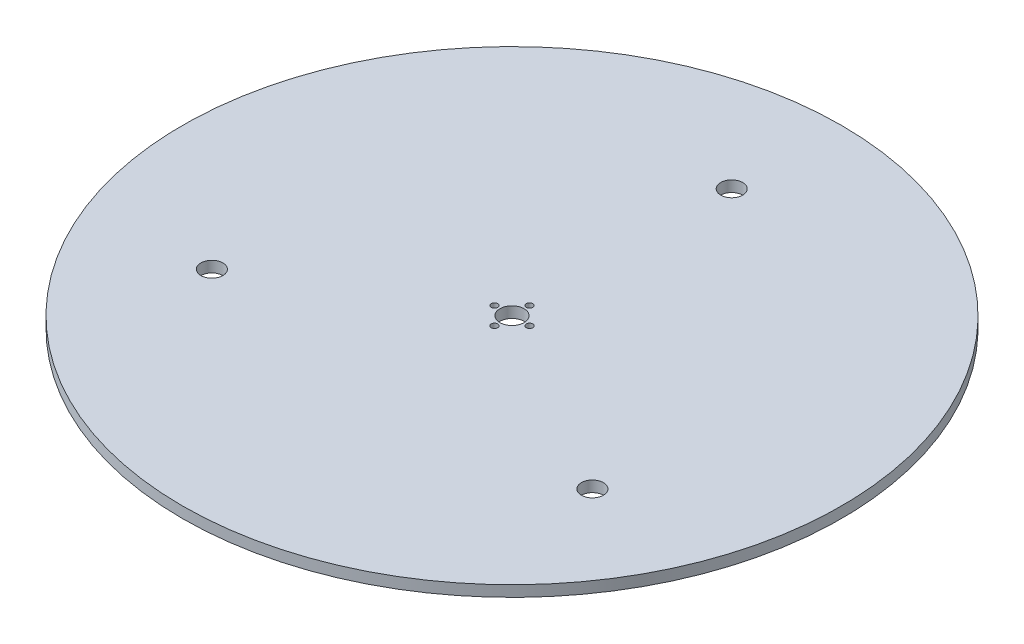
from build123d import *

# Parameters (mm, degrees)
SKETCH_1_R      = 150
SKETCH_1_R_2    = 5
SKETCH_1_R_3    = 5.5
SKETCH_1_R_4    = 1.5
EXTRUDE_1_DEPTH = 5


with BuildPart() as part:
    # 草图1 → 凸台-拉伸1 (new body)
    with BuildSketch(Plane(origin=(0, 0, 0), x_dir=(1, 0, 0), z_dir=(0, 1, 0))):
        with Locations(Location((0, 0, 0), (0, 0, 270))):
            Circle(SKETCH_1_R)
        with Locations(Location((0, 100, 0), (0, 0, 270))):
            Circle(SKETCH_1_R_2, mode=Mode.SUBTRACT)
        with Locations(Location((-86.602540378, -50, 0), (0, 0, 270))):
            Circle(SKETCH_1_R_2, mode=Mode.SUBTRACT)
        with Locations(Location((86.602540378, -50, 0), (0, 0, 270))):
            Circle(SKETCH_1_R_2, mode=Mode.SUBTRACT)
        with Locations(Location((0, 0, 0), (0, 0, 270))):
            Circle(SKETCH_1_R_3, mode=Mode.SUBTRACT)
        with Locations(Location((0, 8, 0), (0, 0, 270))):
            Circle(SKETCH_1_R_4, mode=Mode.SUBTRACT)
        with Locations(Location((8, 0, 0), (0, 0, 270))):
            Circle(SKETCH_1_R_4, mode=Mode.SUBTRACT)
        with Locations(Location((0, -8, 0), (0, 0, 270))):
            Circle(SKETCH_1_R_4, mode=Mode.SUBTRACT)
        with Locations(Location((-8, 0, 0), (0, 0, 270))):
            Circle(SKETCH_1_R_4, mode=Mode.SUBTRACT)
    extrude(amount=EXTRUDE_1_DEPTH)


solid = part.part
